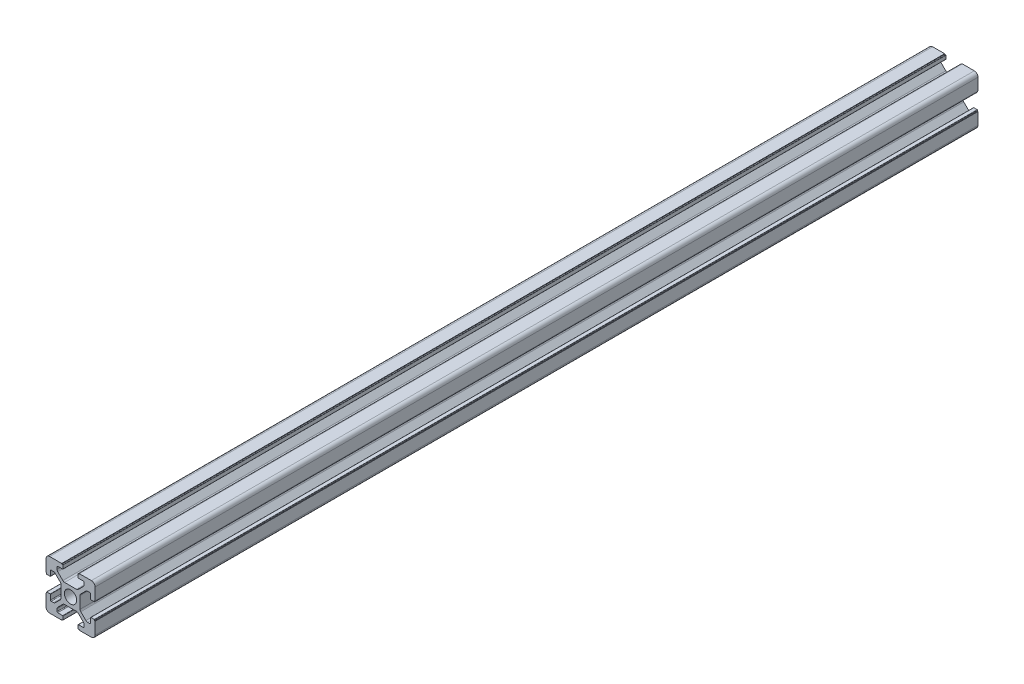
from build123d import *

# Parameters (mm, degrees)
SKETCH_1_R      = 2.5
EXTRUDE_1_DEPTH = 360
FILLET_1_R      = 1.5


with BuildPart() as part:
    # 草图1 → 凸台-拉伸1 (new body)
    with BuildSketch(Plane.XY):
        with BuildLine():
            Line((20, 13.6), (20, 20))
            Line((20, 20), (13.6, 20))
            Line((13.6, 20), (13.6, 19.8))
            Line((13.6, 19.8), (13.2, 19.8))
            ThreePointArc((13.2, 19.8), (13.129289322, 19.770710678), (13.1, 19.7))
            Line((13.1, 19.7), (13.1, 18.3))
            ThreePointArc((13.1, 18.3), (13.129289322, 18.229289322), (13.2, 18.2))
            Line((13.2, 18.2), (15.2, 18.2))
            ThreePointArc((15.2, 18.2), (15.412132034, 18.112132034), (15.5, 17.9))
            Line((15.5, 17.9), (15.5, 16.974873734))
            ThreePointArc((15.5, 16.974873734), (15.423879533, 16.592190302), (15.207106781, 16.267766953))
            Line((15.207106781, 16.267766953), (13.132233047, 14.192893219))
            ThreePointArc((13.132233047, 14.192893219), (12.807809698, 13.976120467), (12.425126266, 13.9))
            Line((12.425126266, 13.9), (7.574873734, 13.9))
            ThreePointArc((7.574873734, 13.9), (7.192190302, 13.976120467), (6.867766953, 14.192893219))
            Line((6.867766953, 14.192893219), (4.792893219, 16.267766953))
            ThreePointArc((4.792893219, 16.267766953), (4.576120467, 16.592190302), (4.5, 16.974873734))
            Line((4.5, 16.974873734), (4.5, 17.9))
            ThreePointArc((4.5, 17.9), (4.587867966, 18.112132034), (4.8, 18.2))
            Line((4.8, 18.2), (6.8, 18.2))
            ThreePointArc((6.8, 18.2), (6.870710678, 18.229289322), (6.9, 18.3))
            Line((6.9, 18.3), (6.9, 19.7))
            ThreePointArc((6.9, 19.7), (6.870710678, 19.770710678), (6.8, 19.8))
            Line((6.8, 19.8), (6.4, 19.8))
            Line((6.4, 19.8), (6.4, 20))
            Line((6.4, 20), (0, 20))
            Line((0, 20), (0, 13.6))
            Line((0, 13.6), (0.2, 13.6))
            Line((0.2, 13.6), (0.2, 13.2))
            ThreePointArc((0.2, 13.2), (0.229289322, 13.129289322), (0.3, 13.1))
            Line((0.3, 13.1), (1.7, 13.1))
            ThreePointArc((1.7, 13.1), (1.770710678, 13.129289322), (1.8, 13.2))
            Line((1.8, 13.2), (1.8, 15.2))
            ThreePointArc((1.8, 15.2), (1.887867966, 15.412132034), (2.1, 15.5))
            Line((2.1, 15.5), (3.025126266, 15.5))
            ThreePointArc((3.025126266, 15.5), (3.407809698, 15.423879533), (3.732233047, 15.207106781))
            Line((3.732233047, 15.207106781), (5.807106781, 13.132233047))
            ThreePointArc((5.807106781, 13.132233047), (6.023879533, 12.807809698), (6.1, 12.425126266))
            Line((6.1, 12.425126266), (6.1, 7.574873734))
            ThreePointArc((6.1, 7.574873734), (6.023879533, 7.192190302), (5.807106781, 6.867766953))
            Line((5.807106781, 6.867766953), (3.732233047, 4.792893219))
            ThreePointArc((3.732233047, 4.792893219), (3.407809698, 4.576120467), (3.025126266, 4.5))
            Line((3.025126266, 4.5), (2.1, 4.5))
            ThreePointArc((2.1, 4.5), (1.887867966, 4.587867966), (1.8, 4.8))
            Line((1.8, 4.8), (1.8, 6.8))
            ThreePointArc((1.8, 6.8), (1.770710678, 6.870710678), (1.7, 6.9))
            Line((1.7, 6.9), (0.3, 6.9))
            ThreePointArc((0.3, 6.9), (0.229289322, 6.870710678), (0.2, 6.8))
            Line((0.2, 6.8), (0.2, 6.4))
            Line((0.2, 6.4), (0, 6.4))
            Line((0, 6.4), (0, 0))
            Line((0, 0), (6.4, 0))
            Line((6.4, 0), (6.4, 0.2))
            Line((6.4, 0.2), (6.8, 0.2))
            ThreePointArc((6.8, 0.2), (6.870710678, 0.229289322), (6.9, 0.3))
            Line((6.9, 0.3), (6.9, 1.7))
            ThreePointArc((6.9, 1.7), (6.870710678, 1.770710678), (6.8, 1.8))
            Line((6.8, 1.8), (4.8, 1.8))
            ThreePointArc((4.8, 1.8), (4.587867966, 1.887867966), (4.5, 2.1))
            Line((4.5, 2.1), (4.5, 3.025126266))
            ThreePointArc((4.5, 3.025126266), (4.576120467, 3.407809698), (4.792893219, 3.732233047))
            Line((4.792893219, 3.732233047), (6.867766953, 5.807106781))
            ThreePointArc((6.867766953, 5.807106781), (7.192190302, 6.023879533), (7.574873734, 6.1))
            Line((7.574873734, 6.1), (12.425126266, 6.1))
            ThreePointArc((12.425126266, 6.1), (12.807809698, 6.023879533), (13.132233047, 5.807106781))
            Line((13.132233047, 5.807106781), (15.207106781, 3.732233047))
            ThreePointArc((15.207106781, 3.732233047), (15.423879533, 3.407809698), (15.5, 3.025126266))
            Line((15.5, 3.025126266), (15.5, 2.1))
            ThreePointArc((15.5, 2.1), (15.412132034, 1.887867966), (15.2, 1.8))
            Line((15.2, 1.8), (13.2, 1.8))
            ThreePointArc((13.2, 1.8), (13.129289322, 1.770710678), (13.1, 1.7))
            Line((13.1, 1.7), (13.1, 0.3))
            ThreePointArc((13.1, 0.3), (13.129289322, 0.229289322), (13.2, 0.2))
            Line((13.2, 0.2), (13.6, 0.2))
            Line((13.6, 0.2), (13.6, 0))
            Line((13.6, 0), (20, 0))
            Line((20, 0), (20, 6.4))
            Line((20, 6.4), (19.8, 6.4))
            Line((19.8, 6.4), (19.8, 6.8))
            ThreePointArc((19.8, 6.8), (19.770710678, 6.870710678), (19.7, 6.9))
            Line((19.7, 6.9), (18.3, 6.9))
            ThreePointArc((18.3, 6.9), (18.229289322, 6.870710678), (18.2, 6.8))
            Line((18.2, 6.8), (18.2, 4.8))
            ThreePointArc((18.2, 4.8), (18.112132034, 4.587867966), (17.9, 4.5))
            Line((17.9, 4.5), (16.974873734, 4.5))
            ThreePointArc((16.974873734, 4.5), (16.592190302, 4.576120467), (16.267766953, 4.792893219))
            Line((16.267766953, 4.792893219), (14.192893219, 6.867766953))
            ThreePointArc((14.192893219, 6.867766953), (13.976120467, 7.192190302), (13.9, 7.574873734))
            Line((13.9, 7.574873734), (13.9, 12.425126266))
            ThreePointArc((13.9, 12.425126266), (13.976120467, 12.807809698), (14.192893219, 13.132233047))
            Line((14.192893219, 13.132233047), (16.267766953, 15.207106781))
            ThreePointArc((16.267766953, 15.207106781), (16.592190302, 15.423879533), (16.974873734, 15.5))
            Line((16.974873734, 15.5), (17.9, 15.5))
            ThreePointArc((17.9, 15.5), (18.112132034, 15.412132034), (18.2, 15.2))
            Line((18.2, 15.2), (18.2, 13.2))
            ThreePointArc((18.2, 13.2), (18.229289322, 13.129289322), (18.3, 13.1))
            Line((18.3, 13.1), (19.7, 13.1))
            ThreePointArc((19.7, 13.1), (19.770710678, 13.129289322), (19.8, 13.2))
            Line((19.8, 13.2), (19.8, 13.6))
            Line((19.8, 13.6), (20, 13.6))
        make_face()
        with Locations(Location((10, 10, 0), (0, 0, 180))):
            Circle(SKETCH_1_R, mode=Mode.SUBTRACT)
    extrude(amount=EXTRUDE_1_DEPTH)

    # 圆角1
    fillet_1_edges = [part.edges().sort_by_distance(p)[0] for p in [
        (0, 0, 180),
        (0, 20, 180),
        (20, 20, 180),
        (20, 0, 180),
    ]]
    fillet(fillet_1_edges, radius=FILLET_1_R)


solid = part.part
